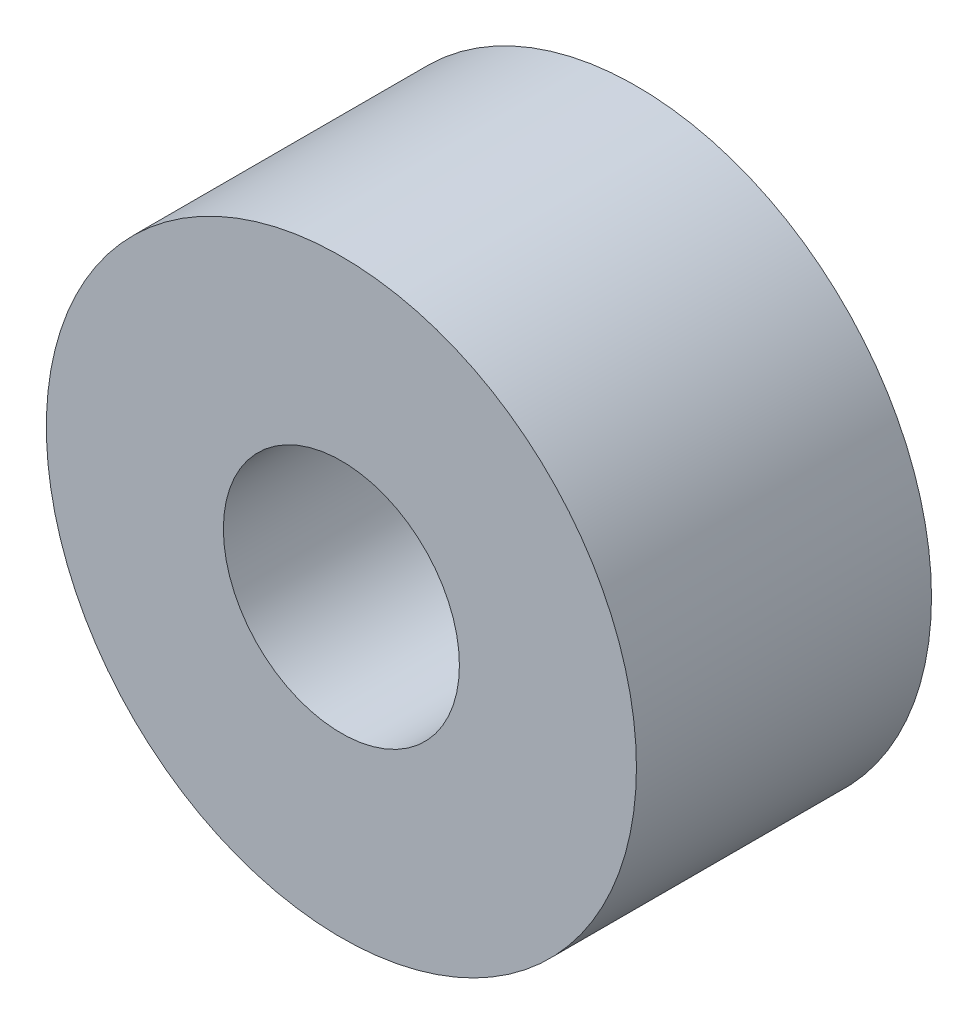
from build123d import *

# Parameters (mm, degrees)
SKETCH_1_R      = 2.5
SKETCH_1_R_2    = 1
EXTRUDE_1_DEPTH = 2.5


with BuildPart() as part:
    # 草图1 → 凸台-拉伸1 (new body)
    with BuildSketch(Plane.XY):
        Circle(SKETCH_1_R)
        Circle(SKETCH_1_R_2, mode=Mode.SUBTRACT)
    extrude(amount=EXTRUDE_1_DEPTH)


solid = part.part
